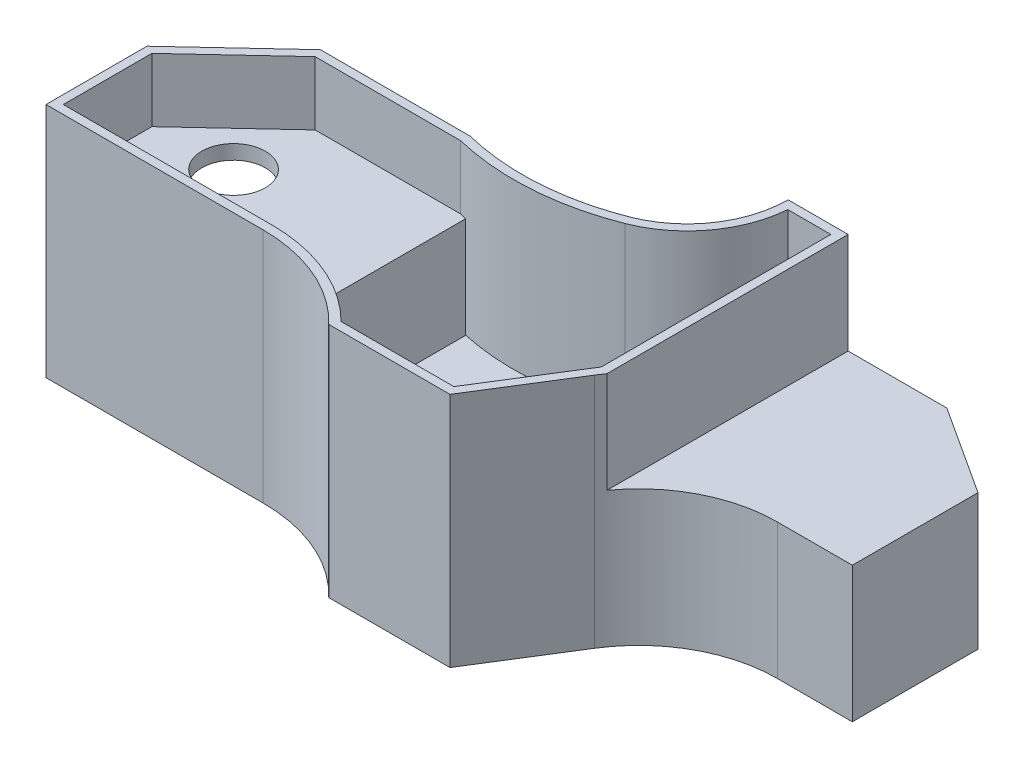
from build123d import *

# Parameters (mm, degrees)
SKETCH1_R           = 16.5
BOSS_EXTRUDE1_DEPTH = 82
SKETCH2_R           = 11
CUT_EXTRUDE1_DEPTH  = 276.268959383
SKETCH5_W           = 65
SKETCH5_H           = 35
CUT_EXTRUDE2_DEPTH  = 282.890049487
CUT_EXTRUDE3_DEPTH  = 40
SKETCH9_R           = 11
CUT_EXTRUDE4_DEPTH  = 22
SKETCH10_R          = 16.5
CUT_EXTRUDE5_DEPTH  = 57


with BuildPart() as part:
    # Sketch1 → Boss-Extrude1 (new body)
    with BuildSketch(Plane(origin=(0, 0, 0), x_dir=(1, 0, 0), z_dir=(0, 1, 0))):
        with BuildLine():
            Line((212.202700724, 100), (157.202700724, 100))
            ThreePointArc((157.202700724, 100), (151.120923095, 80.283600356), (134.9891913, 67.419244043))
            ThreePointArc((134.9891913, 67.419244043), (109.260251558, 61.670356138), (83, 64))
            Line((83, 64), (31.098692591, 64))
            Line((31.098692591, 64), (0, 35))
            Line((0, 35), (0, 0))
            Line((0, 0), (75.238209296, 0))
            ThreePointArc((75.238209296, 0), (96.859957606, -4.428268766), (115, -17))
            Line((115, -17), (157, -17))
            Line((157, -17), (176.293691384, 13.876360515))
            ThreePointArc((176.293691384, 13.876360515), (193.729138228, 30.421981775), (217, 36.440235832))
            Line((217, 36.440235832), (243, 36.440235832))
            Line((243, 36.440235832), (243, 80))
            Line((243, 80), (212.202700724, 100))
        make_face()
        with Locations(Location((135, 43, 0), (0, 0, 270))):
            Circle(SKETCH1_R, mode=Mode.SUBTRACT)
    extrude(amount=BOSS_EXTRUDE1_DEPTH)

    # Sketch2 → Cut-Extrude1 (cut, through all)
    with BuildSketch(Plane(origin=(0, 82, 0), x_dir=(1, 0, 0), z_dir=(0, 1, 0))):
        with Locations(Location((30, 35, 0), (0, 0, 270))):
            Circle(SKETCH2_R)
    extrude(amount=-CUT_EXTRUDE1_DEPTH, mode=Mode.SUBTRACT)

    # Sketch5 → Cut-Extrude2 (cut, through all)
    with BuildSketch(Plane(origin=(0, 0, -100), x_dir=(-1, 0, 0), z_dir=(0, 0, -1))):
        with Locations((-210.5, 64.5)):
            Rectangle(SKETCH5_W, SKETCH5_H)
    extrude(amount=-CUT_EXTRUDE2_DEPTH, mode=Mode.SUBTRACT)

    # Sketch6 → Cut-Extrude3 (cut)
    with BuildSketch(Plane(origin=(0, 15, 0), x_dir=(-1, 0, 0), z_dir=(0, -1, 0))):
        with BuildLine():
            Line((0, 12), (0, 35))
            Line((0, 35), (-31.098692591, 64))
            Line((-31.098692591, 64), (-74.689647512, 64))
            ThreePointArc((-74.689647512, 64), (-49.282519579, 20.85341744), (0, 12))
        make_face()
    extrude(amount=-CUT_EXTRUDE3_DEPTH, mode=Mode.SUBTRACT)

    # Sketch9 → Cut-Extrude4 (cut)
    with BuildSketch(Plane(origin=(0, 82, 0), x_dir=(1, 0, 0), z_dir=(0, 1, 0))):
        with BuildLine():
            Line((85, 2.172610945), (85, 60.459646479))
            ThreePointArc((85, 60.459646479), (83.816874247, 60.721767227), (82.637433549, 61))
            Line((82.637433549, 61), (32.280424018, 61))
            Line((32.280424018, 61), (3, 33.695562875))
            Line((3, 33.695562875), (3, 3))
            Line((3, 3), (75.238209296, 3))
            ThreePointArc((75.238209296, 3), (80.136605217, 2.792782572), (85, 2.172610945))
        make_face()
        with Locations(Location((30, 35, 0), (0, 0, 90))):
            Circle(SKETCH9_R, mode=Mode.SUBTRACT)
    extrude(amount=-CUT_EXTRUDE4_DEPTH, mode=Mode.SUBTRACT)

    # Sketch10 → Cut-Extrude5 (cut)
    with BuildSketch(Plane(origin=(0, 82, 0), x_dir=(1, 0, 0), z_dir=(0, 1, 0))):
        with BuildLine():
            ThreePointArc((136.085176207, 64.626607818), (110.849591358, 58.779397637), (85, 60.459646479))
            Line((85, 60.459646479), (85, 2.172610945))
            ThreePointArc((85, 2.172610945), (101.887734543, -3.484926438), (116.262592289, -14))
            Line((116.262592289, -14), (155.337072846, -14))
            Line((155.337072846, -14), (173.749547096, 15.466118308))
            ThreePointArc((173.749547096, 15.466118308), (174.364131851, 16.425638226), (175, 17.371188115))
            Line((175, 17.371188115), (175, 97))
            Line((175, 97), (160.084094573, 97))
            ThreePointArc((160.084094573, 97), (152.729470491, 77.370012647), (136.085176207, 64.626607818))
        make_face()
        with Locations(Location((135, 43, 0), (0, 0, 270))):
            Circle(SKETCH10_R, mode=Mode.SUBTRACT)
    extrude(amount=-CUT_EXTRUDE5_DEPTH, mode=Mode.SUBTRACT)


solid = part.part
